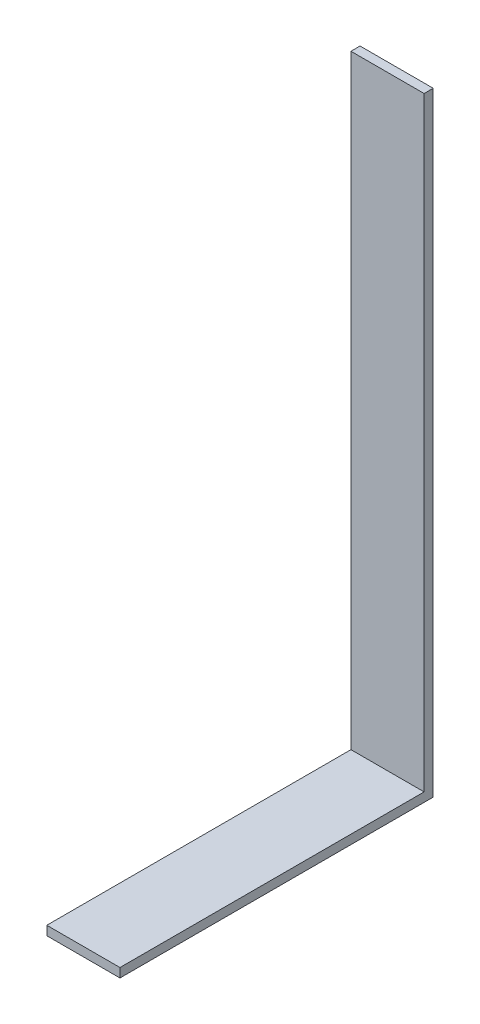
from build123d import *

# Parameters (mm, degrees)
CROQUIS1_W              = 50.8
CROQUIS1_H              = 6.31
SALIENTE_EXTRUIR1_DEPTH = 285.44
CROQUIS3_W              = 50.8
CROQUIS3_H              = 6.31
SALIENTE_EXTRUIR2_DEPTH = 544.51
CROQUIS4_W              = 50.8
CROQUIS4_H              = 6.31
CROQUIS5_W              = 50.8
CROQUIS5_H              = 68
CORTAR_EXTRUIR1_DEPTH   = 10
CROQUIS11_W             = 48.12
CROQUIS11_H             = 211.5
CORTAR_EXTRUIR2_DEPTH   = 50.8


with BuildPart() as part:
    # Croquis1 → Saliente-Extruir1 (new body)
    with BuildSketch(Plane.XY):
        Rectangle(CROQUIS1_W, CROQUIS1_H)
    extrude(amount=SALIENTE_EXTRUIR1_DEPTH)

    # Croquis3 → Saliente-Extruir2 (add)
    with BuildSketch(Plane.XZ.offset(3.155)):
        with Locations((0, 3.155)):
            Rectangle(CROQUIS3_W, CROQUIS3_H)
    extrude(amount=-SALIENTE_EXTRUIR2_DEPTH)

    # Barrer1: sweep along a curve in space
    with BuildLine() as barrer1_path:
        Line((0, 541.355, 3.155), (0, 551.355, 3.155))
        Line((0, 551.355, 3.155), (0, 551.355, 44.965))
        Line((0, 551.355, 44.965), (0, 634.515, 44.965))
    # Croquis4 → Barrer1 (sweep)
    with BuildSketch(Plane(origin=(0, 541.355, 0), x_dir=(1, 0, 0), z_dir=(0, 1, 0))):
        with Locations((0, -3.155)):
            Rectangle(CROQUIS4_W, CROQUIS4_H)
    sweep(path=barrer1_path.line, transition=Transition.RIGHT)

    # Croquis5 → Cortar-Extruir1 (cut)
    with BuildSketch(Plane.XZ.offset(3.155)):
        with Locations((0, 251.44)):
            Rectangle(CROQUIS5_W, CROQUIS5_H)
    extrude(amount=-CORTAR_EXTRUIR1_DEPTH, mode=Mode.SUBTRACT)

    # Croquis11 → Cortar-Extruir2 (cut)
    with BuildSketch(Plane(origin=(25.4, 0, 0), x_dir=(0, 0, -1), z_dir=(1, 0, 0))):
        with Locations((-24.06, 528.765)):
            Rectangle(CROQUIS11_W, CROQUIS11_H)
    extrude(amount=-CORTAR_EXTRUIR2_DEPTH, mode=Mode.SUBTRACT)


solid = part.part
